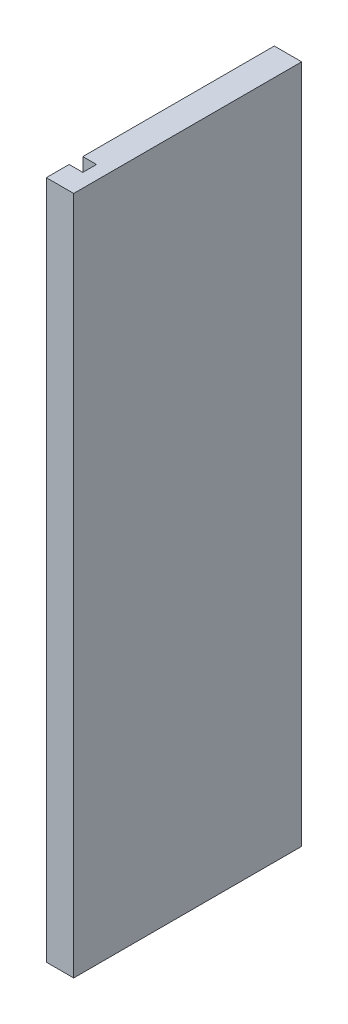
from build123d import *

# Parameters (mm, degrees)
SALIENTE_EXTRUIR1_DEPTH = 298


with BuildPart() as part:
    # Croquis1 → Saliente-Extruir1 (new body)
    with BuildSketch(Plane(origin=(0, 0, 0), x_dir=(1, 0, 0), z_dir=(0, 1, 0))):
        Polygon((12, 24.24476895), (12, -75.75523105), (0, -75.75523105), (0, -65.75523105), (6, -65.75523105), (6, -59.75523105), (0, -59.75523105), (0, 24.24476895), align=None)
    extrude(amount=SALIENTE_EXTRUIR1_DEPTH)


solid = part.part
